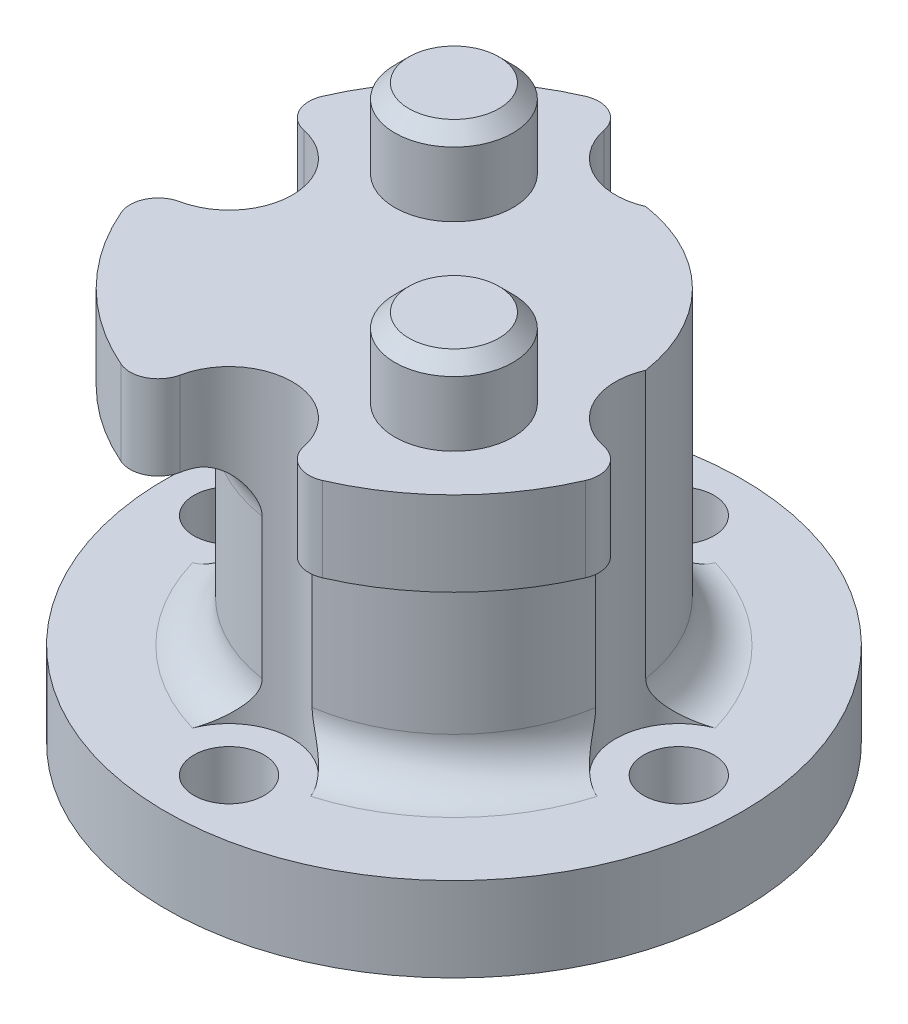
from build123d import *

# Parameters (mm, degrees)
SKETCH3_R           = 1.25
CUT_EXTRUDE1_DEPTH  = 21.152543264
SKETCH4_R           = 2.1
BOSS_EXTRUDE1_DEPTH = 2.8
SKETCH5_R           = 2.25
SKETCH5_R_2         = 1.25
CUT_EXTRUDE2_DEPTH  = 21.014120016
FILLET1_R           = 1.5
CHAMFER1_SIZE       = 0.5
FILLET2_R           = 1
CUT_EXTRUDE3_DEPTH  = 6


with BuildPart() as part:
    # Sketch2 → Revolve2 (revolve)
    with BuildSketch(Plane.XY):
        Polygon((4.1, 2), (4.1, 0), (10.25, 0), (10.25, 3), (6, 3), (6, 11), (9, 11), (9, 14), (0, 14), (0, 2), align=None)
    revolve(axis=Axis((0, 14, 0), (0, -1, 0)))

    # Sketch3 → Cut-Extrude1 (cut, through all)
    with BuildSketch(Plane.XZ):
        with Locations(Location((0, 8, 0), (0, 0, 270))):
            Circle(SKETCH3_R)
        with Locations(Location((8, 0, 0), (0, 0, 270))):
            Circle(SKETCH3_R)
        with Locations(Location((0, -8, 0), (0, 0, 270))):
            Circle(SKETCH3_R)
        with Locations(Location((-8, 0, 0), (0, 0, 270))):
            Circle(SKETCH3_R)
    extrude(amount=-CUT_EXTRUDE1_DEPTH, mode=Mode.SUBTRACT)

    # Sketch4 → Boss-Extrude1 (add)
    with BuildSketch(Plane(origin=(0, 14, 0), x_dir=(1, 0, 0), z_dir=(0, 1, 0))):
        with Locations(Location((-3.535533906, 3.535533906, 0), (0, 0, 270))):
            Circle(SKETCH4_R)
        with Locations(Location((3.535533906, -3.535533906, 0), (0, 0, 270))):
            Circle(SKETCH4_R)
    extrude(amount=BOSS_EXTRUDE1_DEPTH)

    # Sketch5 → Cut-Extrude2 (cut, through all)
    # profile 1 of 4: a face of its own
    with BuildSketch(Plane(origin=(0, 3, 0), x_dir=(1, 0, 0), z_dir=(0, 1, 0))):
        with Locations((0, -8)):
            Circle(SKETCH5_R)
        with Locations(Location((0, -8, 0), (0, 0, 90))):
            Circle(SKETCH5_R_2, mode=Mode.SUBTRACT)
    # profile 2 of 4: a face of its own
    with BuildSketch(Plane(origin=(0, 3, 0), x_dir=(1, 0, 0), z_dir=(0, 1, 0))):
        with Locations((-8, 0)):
            Circle(SKETCH5_R)
        with Locations(Location((-8, 0, 0), (0, 0, 90))):
            Circle(SKETCH5_R_2, mode=Mode.SUBTRACT)
    # profile 3 of 4: a face of its own
    with BuildSketch(Plane(origin=(0, 3, 0), x_dir=(1, 0, 0), z_dir=(0, 1, 0))):
        with Locations((0, 8)):
            Circle(SKETCH5_R)
        with Locations(Location((0, 8, 0), (0, 0, 90))):
            Circle(SKETCH5_R_2, mode=Mode.SUBTRACT)
    # profile 4 of 4: a face of its own
    with BuildSketch(Plane(origin=(0, 3, 0), x_dir=(1, 0, 0), z_dir=(0, 1, 0))):
        with Locations((8, 0)):
            Circle(SKETCH5_R)
        with Locations(Location((8, 0, 0), (0, 0, 90))):
            Circle(SKETCH5_R_2, mode=Mode.SUBTRACT)
    extrude(amount=CUT_EXTRUDE2_DEPTH, mode=Mode.SUBTRACT)

    # Fillet1
    fillet1_edges = [part.edges().sort_by_distance(p)[0] for p in [
        (4.242640687, 11, 4.242640687),
        (4.242640687, 3, 4.242640687),
        (-4.242640687, 11, 4.242640687),
        (-4.242640687, 11, -4.242640687),
        (4.242640687, 11, -4.242640687),
        (-4.242640687, 3, 4.242640687),
        (-4.242640687, 3, -4.242640687),
        (4.242640687, 3, -4.242640687),
    ]]
    fillet(fillet1_edges, radius=FILLET1_R)

    # Chamfer1
    chamfer1_edges = [part.edges().sort_by_distance(p)[0] for p in [
        (-3.535533906, 16.8, -5.635533906),
        (3.535533906, 16.8, 1.435533906),
    ]]
    chamfer(chamfer1_edges, length=CHAMFER1_SIZE)

    # Fillet2
    fillet2_edges = [part.edges().sort_by_distance(p)[0] for p in [
        (-2.122697368, 12.5, 8.74609375),
        (2.122697368, 12.5, 8.74609375),
        (-8.74609375, 12.5, -2.122697368),
        (-8.74609375, 12.5, 2.122697368),
        (2.122697368, 12.5, -8.74609375),
        (-2.122697368, 12.5, -8.74609375),
        (8.74609375, 12.5, 2.122697368),
        (8.74609375, 12.5, -2.122697368),
    ]]
    fillet(fillet2_edges, radius=FILLET2_R)

    # Sketch6 → Cut-Extrude3 (cut)
    with BuildSketch(Plane(origin=(0, 14, 0), x_dir=(1, 0, 0), z_dir=(0, 1, 0))):
        with BuildLine():
            Line((0.89020515, 5.93359375), (0.89020515, 14.456034247))
            Line((0.89020515, 14.456034247), (13.499051384, 10.673985998))
            Line((13.499051384, 10.673985998), (14.247339916, 0.89020515))
            Line((14.247339916, 0.89020515), (5.93359375, 0.89020515))
            ThreePointArc((5.93359375, 0.89020515), (4.242640687, 4.242640687), (0.89020515, 5.93359375))
        make_face()
    extrude(amount=-CUT_EXTRUDE3_DEPTH, mode=Mode.SUBTRACT)


solid = part.part
